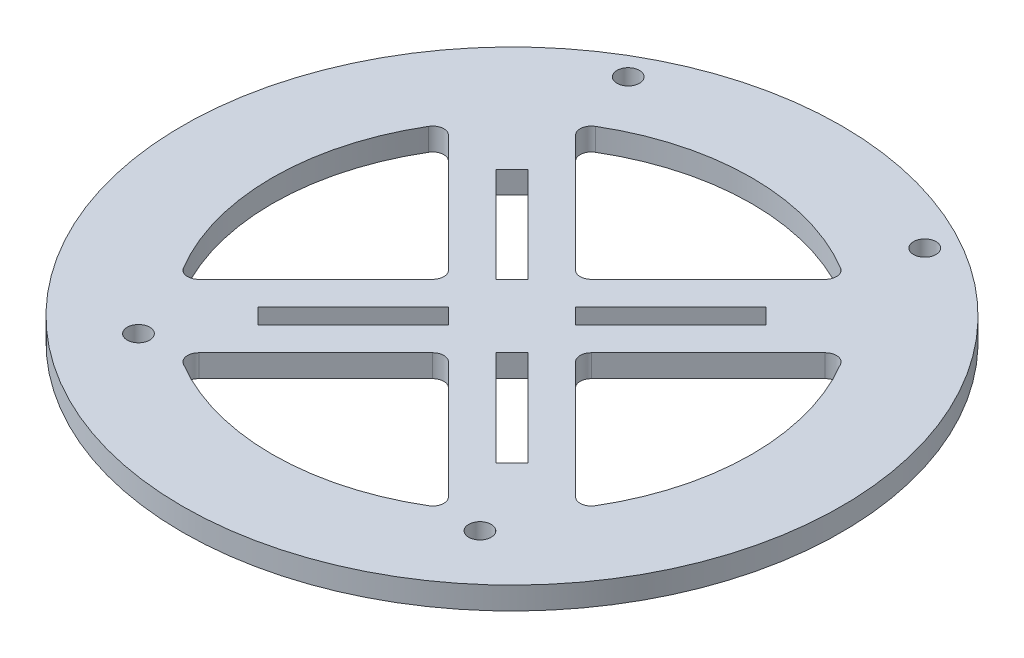
from build123d import *

# Parameters (mm, degrees)
SKETCH1_R           = 46.575911122
SKETCH1_R_2         = 1.5875
SKETCH1_R_3         = 1.587499998
BOSS_EXTRUDE1_DEPTH = 3.175


with BuildPart() as part:
    # Sketch1 → Boss-Extrude1 (new body)
    with BuildSketch(Plane(origin=(0, 0, 0), x_dir=(1, 0, 0), z_dir=(0, 1, 0))):
        with Locations(Location((-1e-09, 0, 0), (0, 0, 270))):
            Circle(SKETCH1_R)
        with Locations(Location((24.022660032, -28.55227459, 0), (0, 0, 270))):
            Circle(SKETCH1_R_2, mode=Mode.SUBTRACT)
        with Locations(Location((-24.237339968, -28.55227459, 0), (0, 0, 270))):
            Circle(SKETCH1_R_3, mode=Mode.SUBTRACT)
        with Locations(Location((-21.062339968, 37.48772541, 0), (0, 0, 270))):
            Circle(SKETCH1_R_2, mode=Mode.SUBTRACT)
        with Locations(Location((20.847660032, 37.48772541, 0), (0, 0, 270))):
            Circle(SKETCH1_R_2, mode=Mode.SUBTRACT)
        with BuildLine():
            Line((-1.12253199, -10.1027881), (-17.640592509, -26.62084862))
            ThreePointArc((-17.640592509, -26.62084862), (-18.09333437, -27.940023623), (-17.330191539, -29.107418543))
            ThreePointArc((-17.330191539, -29.107418543), (1.9e-08, -33.875911102), (17.330191572, -29.107418523))
            ThreePointArc((17.330191572, -29.107418523), (18.093334404, -27.940023602), (17.640592543, -26.620848599))
            Line((17.640592543, -26.620848599), (1.12253204, -10.1027881))
            ThreePointArc((1.12253204, -10.1027881), (2.5e-08, -9.637820115), (-1.12253199, -10.1027881))
        make_face(mode=Mode.SUBTRACT)
        with BuildLine():
            Line((-10.102788112, 1.122532053), (-26.6208486, 17.640592539))
            ThreePointArc((-26.6208486, 17.640592539), (-27.940023602, 18.093334401), (-29.107418522, 17.330191571))
            ThreePointArc((-29.107418522, 17.330191571), (-33.875911101, 2.9e-08), (-29.107418553, -17.330191521))
            ThreePointArc((-29.107418553, -17.330191521), (-27.940023632, -18.093334356), (-26.620848627, -17.640592494))
            Line((-26.620848627, -17.640592494), (-10.102788113, -1.122531976))
            ThreePointArc((-10.102788113, -1.122531976), (-9.637820128, 3.8e-08), (-10.102788112, 1.122532053))
        make_face(mode=Mode.SUBTRACT)
        with BuildLine():
            Line((1.122532046, 10.102788181), (17.640592494, 26.620848628))
            ThreePointArc((17.640592494, 26.620848628), (18.093334353, 27.940023632), (17.33019152, 29.107418551))
            ThreePointArc((17.33019152, 29.107418551), (2.4e-08, 33.8759111), (-17.33019148, 29.107418577))
            ThreePointArc((-17.33019148, 29.107418577), (-18.093334314, 27.940023657), (-17.640592454, 26.620848652))
            Line((-17.640592454, 26.620848652), (-1.122531984, 10.102788181))
            ThreePointArc((-1.122531984, 10.102788181), (3.1e-08, 9.637820197), (1.122532046, 10.102788181))
        make_face(mode=Mode.SUBTRACT)
        with BuildLine():
            Line((26.620848619, 17.64059251), (10.102788169, 1.12253206))
            ThreePointArc((10.102788169, 1.12253206), (9.637820183, 4.4e-08), (10.102788168, -1.122531972))
            Line((10.102788168, -1.122531972), (26.620848653, -17.640592453))
            ThreePointArc((26.620848653, -17.640592453), (27.940023657, -18.093334314), (29.107418578, -17.33019148))
            ThreePointArc((29.107418578, -17.33019148), (33.875911102, 3.4e-08), (29.107418542, 17.330191539))
            ThreePointArc((29.107418542, 17.330191539), (27.940023622, 18.09333437), (26.620848619, 17.64059251))
        make_face(mode=Mode.SUBTRACT)
        Polygon((-19.083044242, -16.837980228), (-16.837980211, -19.083044257), (-3.367596019, -5.612660086), (-5.61266005, -3.367596056), align=None, mode=Mode.SUBTRACT)
        Polygon((16.837980228, -19.083044242), (19.083044257, -16.837980211), (5.612660086, -3.367596019), (3.367596056, -5.61266005), align=None, mode=Mode.SUBTRACT)
        Polygon((19.083044242, 16.837980228), (16.837980211, 19.083044257), (3.367596019, 5.612660086), (5.61266005, 3.367596056), align=None, mode=Mode.SUBTRACT)
        Polygon((-16.837980228, 19.083044242), (-19.083044257, 16.837980211), (-5.612660086, 3.367596019), (-3.367596056, 5.61266005), align=None, mode=Mode.SUBTRACT)
    extrude(amount=BOSS_EXTRUDE1_DEPTH)


solid = part.part
